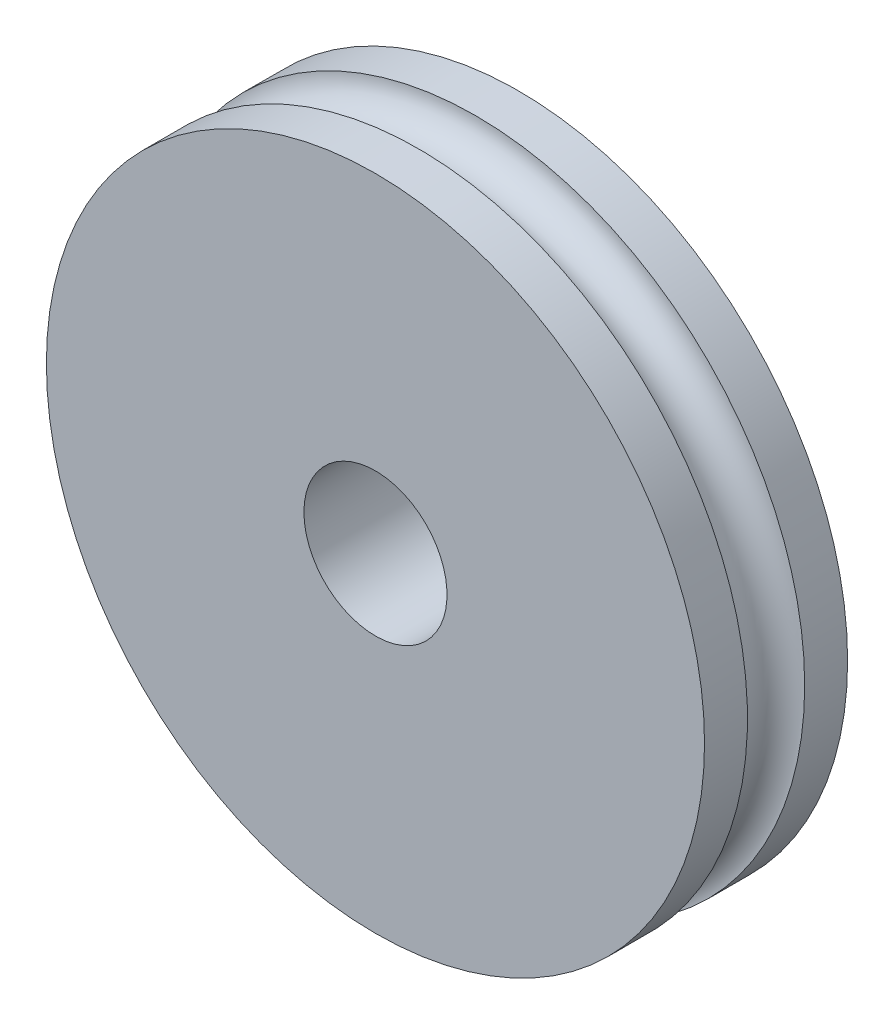
from build123d import *

# Parameters (mm, degrees)
SKETCH1_R           = 115
BOSS_EXTRUDE1_DEPTH = 50
SKETCH2_R           = 10
SKETCH3_R           = 25
CUT_EXTRUDE1_DEPTH  = 171.146995272


with BuildPart() as part:
    # Sketch1 → Boss-Extrude1 (new body)
    with BuildSketch(Plane.XY):
        Circle(SKETCH1_R)
    extrude(amount=BOSS_EXTRUDE1_DEPTH)

    # Sketch2 → Cut-Revolve1 (revolve, cut)
    with BuildSketch(Plane(origin=(0, 0, 0), x_dir=(0, 0, -1), z_dir=(1, 0, 0)), mode=Mode.PRIVATE) as cut_revolve1_sk:
        with Locations((-25, 115)):
            Circle(SKETCH2_R)
    revolve(cut_revolve1_sk.sketch.rotate(Axis((0, 0, 0), (0, 0, 1)), 90), axis=Axis((0, 0, 0), (0, 0, 1)), mode=Mode.SUBTRACT)

    # Sketch3 → Cut-Extrude1 (cut, through all)
    with BuildSketch(Plane(origin=(0, 0, 0), x_dir=(-1, 0, 0), z_dir=(0, 0, -1))):
        Circle(SKETCH3_R)
    extrude(amount=-CUT_EXTRUDE1_DEPTH, mode=Mode.SUBTRACT)


solid = part.part
